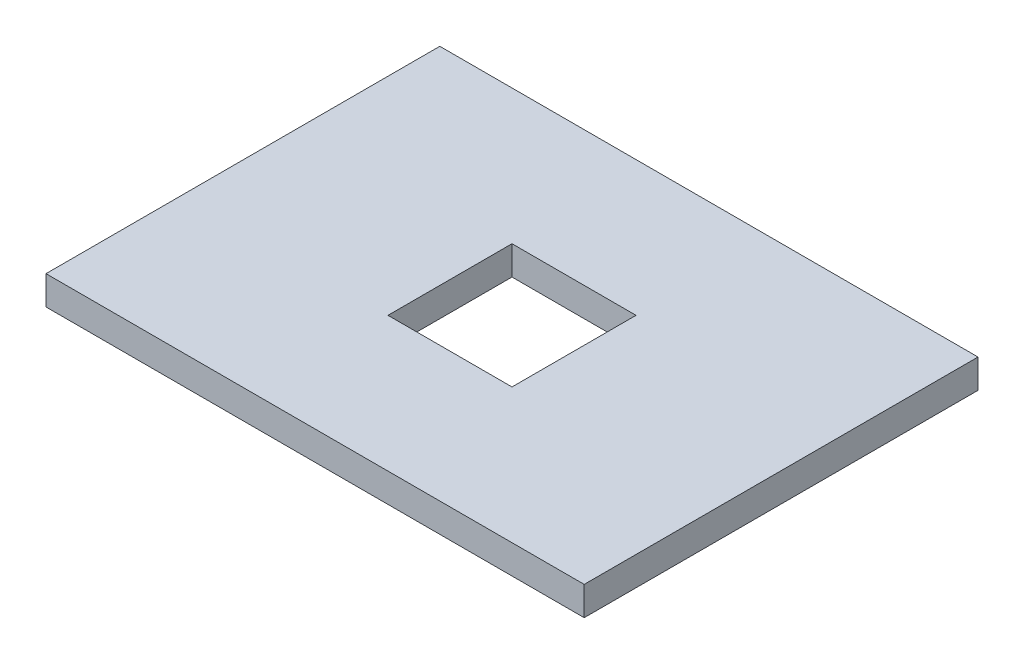
from build123d import *

# Parameters (mm, degrees)
SKETCH1_W           = 260.35
SKETCH1_H           = 190.5
BOSS_EXTRUDE1_DEPTH = 13.97
SKETCH3_W           = 60
SKETCH3_H           = 60
CUT_EXTRUDE2_DEPTH  = 162.905077206


with BuildPart() as part:
    # Sketch1 → Boss-Extrude1 (new body)
    with BuildSketch(Plane(origin=(0, 0, 0), x_dir=(1, 0, 0), z_dir=(0, 1, 0))):
        Rectangle(SKETCH1_W, SKETCH1_H)
    extrude(amount=BOSS_EXTRUDE1_DEPTH)

    # Sketch3 → Cut-Extrude2 (cut, through all)
    with BuildSketch(Plane(origin=(0, 13.97, 0), x_dir=(1, 0, 0), z_dir=(0, 1, 0))):
        Rectangle(SKETCH3_W, SKETCH3_H)
    extrude(amount=-CUT_EXTRUDE2_DEPTH, mode=Mode.SUBTRACT)


solid = part.part
